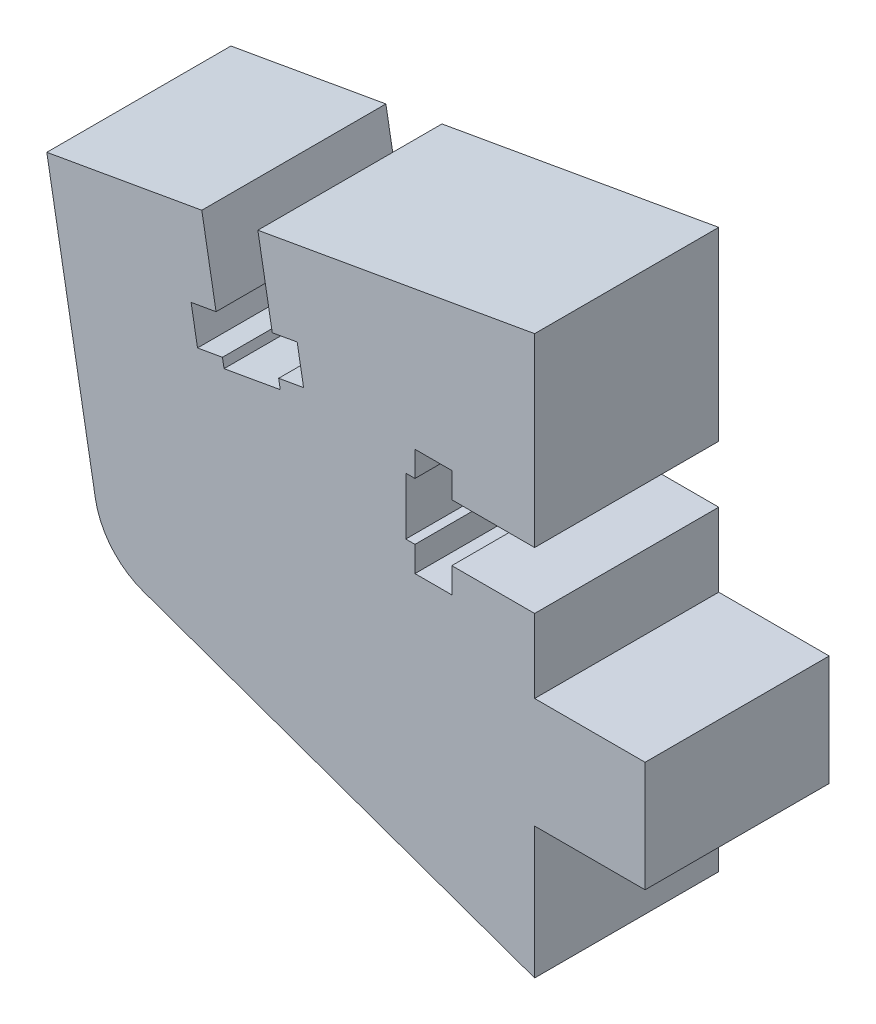
from build123d import *

# Parameters (mm, degrees)
DODANIE_WYCI_GNI_CIE1_DEPTH = 10


with BuildPart() as part:
    # Szkic1 → Dodanie-wyciągnięcie1 (new body)
    with BuildSketch(Plane.XY):
        with BuildLine():
            Line((269.016524324, -406.868519497), (271.654292788, -421.82804783))
            ThreePointArc((271.654292788, -421.82804783), (272.538891868, -423.715939148), (274.253329281, -424.902258464))
            Line((274.253329281, -424.902258464), (295.514699013, -432.462846953))
            Line((295.514699013, -432.462846953), (295.514699013, -425.313881279))
            Line((295.514699013, -425.313881279), (301.514699013, -425.313881279))
            Line((301.514699013, -425.313881279), (301.514699013, -419.313881279))
            Line((301.514699013, -419.313881279), (295.514699013, -419.313881279))
            Line((295.514699013, -419.313881279), (295.514699013, -415.313881279))
            Line((295.514699013, -415.313881279), (291.014699013, -415.313881279))
            Line((291.014699013, -415.313881279), (291.014699013, -416.688881279))
            Line((291.014699013, -416.688881279), (289.014699013, -416.688881279))
            Line((289.014699013, -416.688881279), (289.014699013, -415.313881279))
            Line((289.014699013, -415.313881279), (288.514699013, -415.313881279))
            Line((288.514699013, -415.313881279), (288.514699013, -412.213881279))
            Line((288.514699013, -412.213881279), (289.014699013, -412.213881279))
            Line((289.014699013, -412.213881279), (289.014699013, -410.838881279))
            Line((289.014699013, -410.838881279), (291.014699013, -410.838881279))
            Line((291.014699013, -410.838881279), (291.014699013, -412.213881279))
            Line((291.014699013, -412.213881279), (295.514699013, -412.213881279))
            Line((295.514699013, -412.213881279), (295.514699013, -402.150585233))
            Line((295.514699013, -402.150585233), (280.48065548, -404.801492737))
            Line((280.48065548, -404.801492737), (281.26207228, -409.233127626))
            Line((281.26207228, -409.233127626), (282.61618294, -408.994361382))
            Line((282.61618294, -408.994361382), (282.963479295, -410.963976888))
            Line((282.963479295, -410.963976888), (281.609368635, -411.202743132))
            Line((281.609368635, -411.202743132), (281.696192724, -411.695147008))
            Line((281.696192724, -411.695147008), (278.64328869, -412.233456359))
            Line((278.64328869, -412.233456359), (278.556464601, -411.741052483))
            Line((278.556464601, -411.741052483), (277.20235394, -411.979818727))
            Line((277.20235394, -411.979818727), (276.855057585, -410.010203221))
            Line((276.855057585, -410.010203221), (278.209168245, -409.771436977))
            Line((278.209168245, -409.771436977), (277.435547988, -405.384018473))
            Line((277.435547988, -405.384018473), (269.016524324, -406.868519497))
        make_face()
    extrude(amount=DODANIE_WYCI_GNI_CIE1_DEPTH)


solid = part.part
